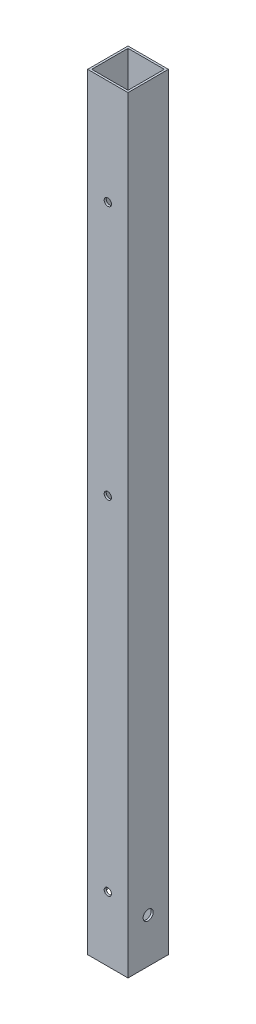
from build123d import *

# Parameters (mm, degrees)
SKETCH1_W           = 25.4
SKETCH1_H           = 25.4
BOSS_EXTRUDE1_DEPTH = 482.6
SKETCH2_R           = 2.286
CUT_EXTRUDE1_DEPTH  = 484.934995635
SKETCH3_R           = 2.286
CUT_EXTRUDE2_DEPTH  = 484.934995635
SKETCH4_R           = 2.286
CUT_EXTRUDE3_DEPTH  = 484.934995635
SKETCH9_R           = 3.175
CUT_EXTRUDE8_DEPTH  = 484.934995635


with BuildPart() as part:
    # Sketch1 → Boss-Extrude1 (new body)
    with BuildSketch(Plane(origin=(0, 0, 0), x_dir=(1, 0, 0), z_dir=(0, 1, 0))):
        with Locations((12.7, 12.7)):
            Rectangle(SKETCH1_W, SKETCH1_H)
        Polygon((1.27, 12.361459156), (1.27, 24.13), (12.7, 24.13), (24.13, 24.13), (24.13, 12.7), (24.13, 1.27), (12.7, 1.27), (1.27, 1.27), align=None, mode=Mode.SUBTRACT)
    extrude(amount=BOSS_EXTRUDE1_DEPTH)

    # Sketch2 → Cut-Extrude1 (cut, through all)
    with BuildSketch(Plane(origin=(0, 0, -25.4), x_dir=(-1, 0, 0), z_dir=(0, 0, -1))):
        with Locations((-12.7, 416.56)):
            Circle(SKETCH2_R)
    extrude(amount=-CUT_EXTRUDE1_DEPTH, mode=Mode.SUBTRACT)

    # Sketch3 → Cut-Extrude2 (cut, through all)
    with BuildSketch(Plane(origin=(0, 0, -25.4), x_dir=(-1, 0, 0), z_dir=(0, 0, -1))):
        with Locations((-12.7, 40.64)):
            Circle(SKETCH3_R)
    extrude(amount=-CUT_EXTRUDE2_DEPTH, mode=Mode.SUBTRACT)

    # Sketch4 → Cut-Extrude3 (cut, through all)
    with BuildSketch(Plane(origin=(0, 0, -25.4), x_dir=(-1, 0, 0), z_dir=(0, 0, -1))):
        with Locations((-12.7, 256.54)):
            Circle(SKETCH4_R)
    extrude(amount=-CUT_EXTRUDE3_DEPTH, mode=Mode.SUBTRACT)

    # Sketch9 → Cut-Extrude8 (cut, through all)
    with BuildSketch(Plane.ZY):
        with Locations((-12.7, 27.94)):
            Circle(SKETCH9_R)
    extrude(amount=-CUT_EXTRUDE8_DEPTH, mode=Mode.SUBTRACT)


solid = part.part
